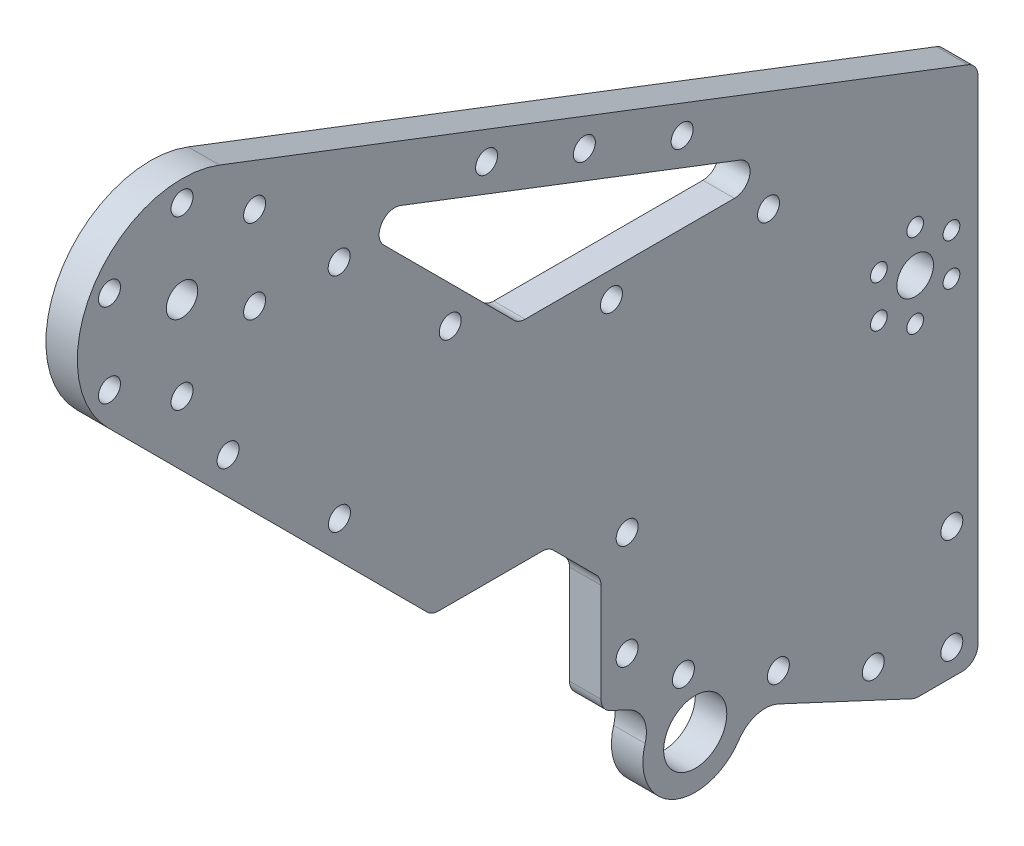
from build123d import *

# Parameters (mm, degrees)
SKETCH_1_R               = 3.5
EXTRUDE_1_DEPTH          = 3
SKETCH_2_R               = 3
SKETCH_2_R_2             = 2.1
CUT_EXTRUDE_1_DEPTH      = 10
SKETCH_4_R               = 2.1
CUT_EXTRUDE_3_DEPTH      = 10
CHAMFER_1_SIZE           = 10
FILLET_1_R               = 3
SKETCH_5_R               = 2.1
CUT_EXTRUDE_4_DEPTH      = 10
SKETCH_3_R               = 1.6
CUT_EXTRUDE_5_DEPTH      = 10
EXTRUDE_2_DEPTH          = 6
CUT_EXTRUDE_6_DEPTH      = 182.747077005
CUT_EXTRUDE_6_DEPTH_BACK = 182.747077005
SKETCH_6_3_R             = 6.025
FILLET_2_R               = 6
SKETCH_7_R               = 2.1
EXTRUDE_3_DEPTH          = 6
FILLET_3_R               = 3


with BuildPart() as part:
    # 草图1 → 凸台-拉伸1 (new, symmetric)
    with BuildSketch(Plane(origin=(0, 0, 0), x_dir=(0, 0, -1), z_dir=(1, 0, 0))):
        with BuildLine():
            Line((-60, -42.021540511), (0, -70))
            Line((0, -70), (12, -70))
            Line((12, -70), (12, 30))
            Line((12, 30), (-75.715728753, 30))
            Line((-75.715728753, 30), (-125.857864376, 80.142135624))
            ThreePointArc((-125.857864376, 80.142135624), (-154.142135624, 80.142135624), (-154.142135624, 51.857864376))
            Line((-154.142135624, 51.857864376), (-92.284271247, -10))
            Line((-92.284271247, -10), (-60, -10))
            Line((-60, -10), (-60, -42.021540511))
        make_face()
        Circle(SKETCH_1_R, mode=Mode.SUBTRACT)
    extrude(amount=EXTRUDE_1_DEPTH, both=True)

    # 草图2 → 切除-拉伸1 (cut)
    with BuildSketch(Plane(origin=(3, 0, 0), x_dir=(0, 0, -1), z_dir=(1, 0, 0))):
        with Locations((-140, 66)):
            Circle(SKETCH_2_R)
        with Locations((-140, 82)):
            Circle(SKETCH_2_R_2)
        with Locations((-126.143593539, 74)):
            Circle(SKETCH_2_R_2)
        with Locations((-126.143593539, 58)):
            Circle(SKETCH_2_R_2)
        with Locations((-140, 50)):
            Circle(SKETCH_2_R_2)
        with Locations((-153.856406461, 58)):
            Circle(SKETCH_2_R_2)
        with Locations((-153.856406461, 74)):
            Circle(SKETCH_2_R_2)
    extrude(amount=-CUT_EXTRUDE_1_DEPTH, mode=Mode.SUBTRACT)

    # 草图4 → 切除-拉伸3 (cut)
    with BuildSketch(Plane(origin=(3, 0, 0), x_dir=(0, 0, -1), z_dir=(1, 0, 0))):
        with Locations((-55, -15)):
            Circle(SKETCH_4_R)
        with Locations((-55, -35)):
            Circle(SKETCH_4_R)
        with Locations((7, -65)):
            Circle(SKETCH_4_R)
        with Locations((7, -45)):
            Circle(SKETCH_4_R)
        with Locations((-8, -60.75264914)):
            Circle(SKETCH_4_R)
        with Locations((-26.126155741, -52.300283905)):
            Circle(SKETCH_4_R)
        with Locations((-44.252311481, -43.84791867)):
            Circle(SKETCH_4_R)
    extrude(amount=-CUT_EXTRUDE_3_DEPTH, mode=Mode.SUBTRACT)

    # 倒角1
    chamfer_1_edges = [part.edges().sort_by_distance(p)[0] for p in [
        (0, -10, 60),
    ]]
    chamfer(chamfer_1_edges, length=CHAMFER_1_SIZE)

    # 圆角1
    fillet_1_edges = [part.edges().sort_by_distance(p)[0] for p in [
        (0, -20, 60),
        (0, -10, 70),
        (0, 30, -12),
        (0, -70, -12),
        (0, -70, 0),
        (0, -42.021540511, 60),
        (0, -10, 92.284271247),
        (0, 30, 75.715728753),
    ]]
    fillet(fillet_1_edges, radius=FILLET_1_R)

    # 草图5 → 切除-拉伸4 (cut)
    with BuildSketch(Plane(origin=(3, 0, 0), x_dir=(0, 0, -1), z_dir=(1, 0, 0))):
        with Locations((-110, 57.213203436)):
            Circle(SKETCH_5_R)
        with Locations((-88.786796564, 36)):
            Circle(SKETCH_5_R)
        with Locations((-109.946763354, 14.785654888)):
            Circle(SKETCH_5_R)
        with Locations((-131.214342006, 35.94434337)):
            Circle(SKETCH_5_R)
        with Locations((-58, 25)):
            Circle(SKETCH_5_R)
        with Locations((-28, 25)):
            Circle(SKETCH_5_R)
    extrude(amount=-CUT_EXTRUDE_4_DEPTH, mode=Mode.SUBTRACT)

    # 草图3 → 切除-拉伸5 (cut)
    with BuildSketch(Plane(origin=(3, 0, 0), x_dir=(0, 0, -1), z_dir=(1, 0, 0))):
        with Locations((0, 8)):
            Circle(SKETCH_3_R)
        with Locations((6.92820323, 4)):
            Circle(SKETCH_3_R)
        with Locations((6.92820323, -4)):
            Circle(SKETCH_3_R)
        with Locations((0, -8)):
            Circle(SKETCH_3_R)
        with Locations((-6.92820323, -4)):
            Circle(SKETCH_3_R)
        with Locations((-6.92820323, 4)):
            Circle(SKETCH_3_R)
    extrude(amount=-CUT_EXTRUDE_5_DEPTH, mode=Mode.SUBTRACT)

    # 草图6 → 凸台-拉伸2 (add)
    with BuildSketch(Plane(origin=(3, 0, 0), x_dir=(0, 0, -1), z_dir=(1, 0, 0))):
        with BuildLine():
            ThreePointArc((-51.06307787, -50.273817383), (-46.226182617, -63.56307787), (-32.93692213, -58.726182617))
            ThreePointArc((-32.93692213, -58.726182617), (-32.302787653, -56.942145102), (-32.016290131, -55.070558726))
            Line((-32.016290131, -55.070558726), (-36.127383127, -53.153524579))
            ThreePointArc((-36.127383127, -53.153524579), (-36.013216988, -53.822464636), (-35.975, -54.5))
            ThreePointArc((-35.975, -54.5), (-45.144179406, -59.639529245), (-44.743385348, -49.13581676))
            Line((-44.743385348, -49.13581676), (-48.854478344, -47.218782613))
            ThreePointArc((-48.854478344, -47.218782613), (-50.10403963, -48.64128498), (-51.06307787, -50.273817383))
        make_face()
        with BuildLine():
            Line((-49.498462108, -46.918488052), (-51.06307787, -50.273817383))
            ThreePointArc((-51.06307787, -50.273817383), (-50.10403963, -48.64128498), (-48.854478344, -47.218782613))
            Line((-48.854478344, -47.218782613), (-49.498462108, -46.918488052))
        make_face()
        with BuildLine():
            ThreePointArc((-32.016290131, -55.070558726), (-32.302787653, -56.942145102), (-32.93692213, -58.726182617))
            Line((-32.93692213, -58.726182617), (-31.372306367, -55.370853287))
            Line((-31.372306367, -55.370853287), (-32.016290131, -55.070558726))
        make_face()
    extrude(amount=-EXTRUDE_2_DEPTH)

    # 草图6<3> → 切除-拉伸6 (cut, two sides: drawn at the far end of the back side and taken through both)
    with BuildSketch(Plane(origin=(3, 0, 0), x_dir=(0, 0, -1), z_dir=(1, 0, 0)).offset(-CUT_EXTRUDE_6_DEPTH_BACK)):
        with Locations((-42, -54.5)):
            Circle(SKETCH_6_3_R)
    extrude(amount=CUT_EXTRUDE_6_DEPTH + CUT_EXTRUDE_6_DEPTH_BACK, mode=Mode.SUBTRACT)

    # 圆角2
    fillet_2_edges = [part.edges().sort_by_distance(p)[0] for p in [
        (0, -46.918488052, 49.498462108),
        (0, -55.370853287, 31.372306367),
    ]]
    fillet(fillet_2_edges, radius=FILLET_2_R)

    # 草图7 → 凸台-拉伸3 (add)
    # profile 1 of 2: a face of its own
    with BuildSketch(Plane(origin=(3, 0, 0), x_dir=(0, 0, -1), z_dir=(1, 0, 0))):
        with BuildLine():
            Line((-61.377870017, 57.235829935), (-132.83107829, 84.671008583))
            ThreePointArc((-132.83107829, 84.671008583), (-129.106517373, 82.772955502), (-125.857864376, 80.142135624))
            Line((-125.857864376, 80.142135624), (-111.475100576, 65.759371824))
            Line((-111.475100576, 65.759371824), (-64.962330872, 47.900325644))
            Line((-64.962330872, 47.900325644), (-63.922837224, 50.607621888))
            ThreePointArc((-63.922837224, 50.607621888), (-65.130556346, 53.320814569), (-62.417363665, 54.528533691))
            Line((-62.417363665, 54.528533691), (-61.377870017, 57.235829935))
        make_face()
        with Locations((-81.841109028, 59.736999499)):
            Circle(SKETCH_7_R, mode=Mode.SUBTRACT)
    # profile 2 of 2: a face of its own
    with BuildSketch(Plane(origin=(3, 0, 0), x_dir=(0, 0, -1), z_dir=(1, 0, 0))):
        with BuildLine():
            Line((10.075338256, 29.800651288), (-61.377870017, 57.235829935))
            Line((-61.377870017, 57.235829935), (-62.417363665, 54.528533691))
            ThreePointArc((-62.417363665, 54.528533691), (-61.439385673, 53.757458461), (-61.070100444, 52.56807779))
            ThreePointArc((-61.070100444, 52.56807779), (-61.980719773, 50.837363019), (-63.922837224, 50.607621888))
            Line((-63.922837224, 50.607621888), (-64.962330872, 47.900325644))
            Line((-64.962330872, 47.900325644), (-18.342051383, 30))
            Line((-18.342051383, 30), (9, 30))
            ThreePointArc((9, 30), (9.546830018, 29.949741841), (10.075338256, 29.800651288))
        make_face()
        with Locations((-44.499091861, 45.39915608)):
            Circle(SKETCH_7_R, mode=Mode.SUBTRACT)
    extrude(amount=-EXTRUDE_3_DEPTH)

    # 圆角3
    fillet_3_edges = [part.edges().sort_by_distance(p)[0] for p in [
        (0, 65.759371824, 111.475100576),
        (0, 30, 18.342051383),
    ]]
    fillet(fillet_3_edges, radius=FILLET_3_R)


solid = part.part
